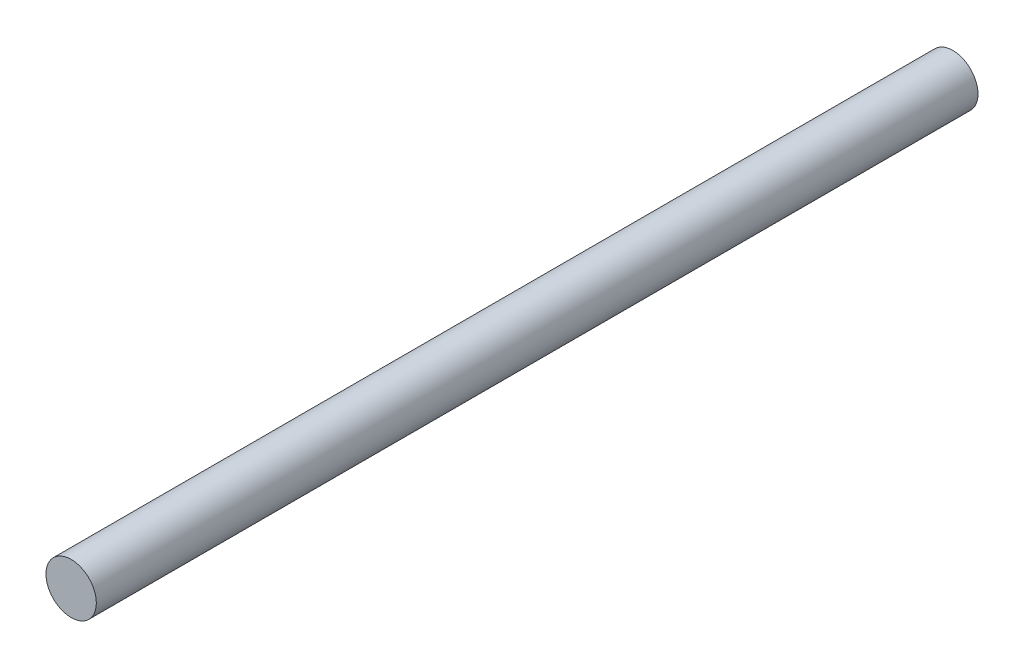
from build123d import *

# Parameters (mm, degrees)
SKETCH1_R           = 3
BOSS_EXTRUDE1_DEPTH = 105


with BuildPart() as part:
    # Sketch1 → Boss-Extrude1 (new body)
    with BuildSketch(Plane.XY):
        Circle(SKETCH1_R)
    extrude(amount=BOSS_EXTRUDE1_DEPTH)


solid = part.part
